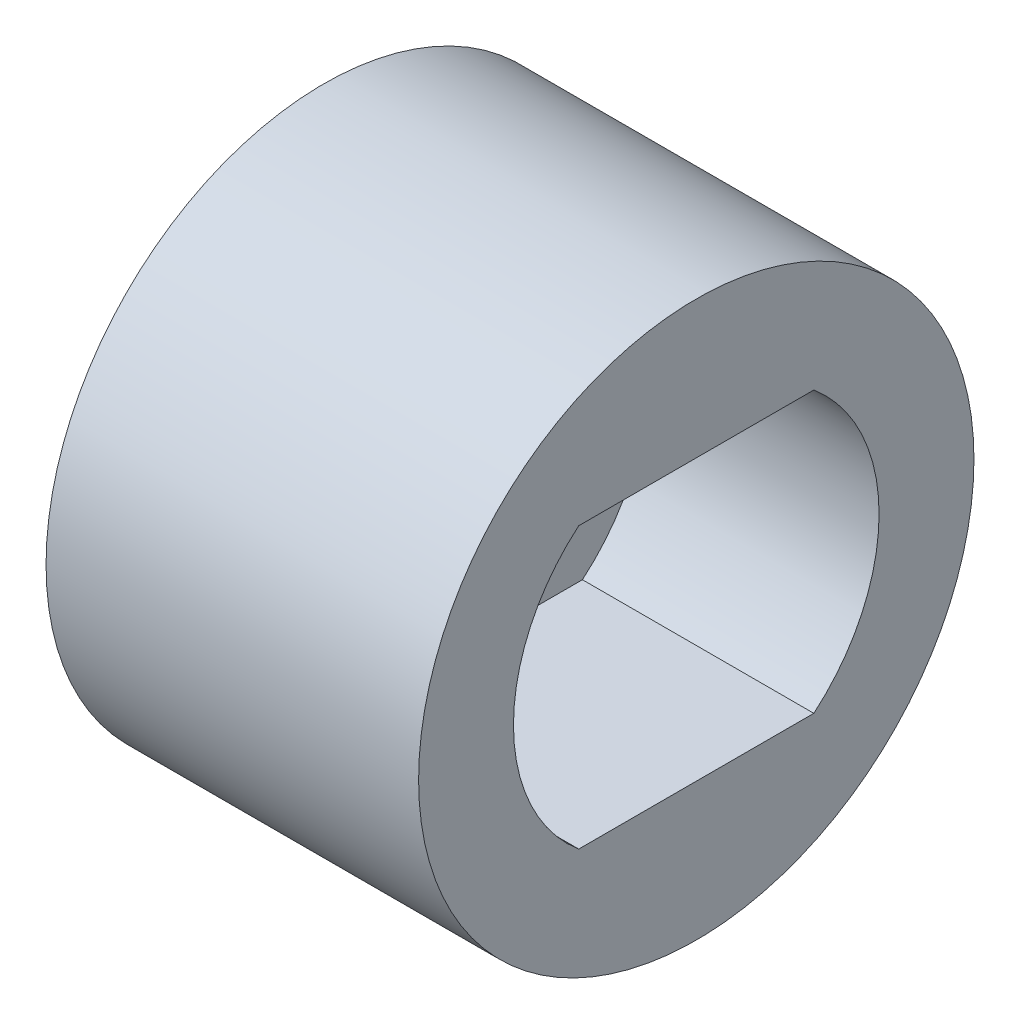
from build123d import *

# Parameters (mm, degrees)
BASPROSKE_W         = 5.1
BASPROSKE_H         = 2
TOOTHCUT_DEPTH      = 18.720327311
TEETHCUTS_COUNT     = 42
TEETHCUTS_ANGLE     = 351.428571429
EXTRUDE_START       = 11
SKETCH_1_R          = 12
SKETCH_1_R_2        = 2.5
EXTRUDE_1_DEPTH     = 11
CUT_EXTRUDE_1_REACH = 23.224
CUT_EXTRUDE_START   = 1
SKETCH_1_3_R        = 2.5


with BuildPart() as part:
    # BasProSke → Base-Revolve (revolve)
    with BuildSketch(Plane(origin=(0, 0, 0), x_dir=(1, 0, 0), z_dir=(0, 1, 0))):
        with Locations((2.55, 11)):
            Rectangle(BASPROSKE_W, BASPROSKE_H)
    revolve(axis=Axis((-10, 0, 0), (1, 0, 0)))

    # TooCutSke → ToothCut (cut, through all)
    with BuildSketch(Plane(origin=(0, 0, 0), x_dir=(0, 0, -1), z_dir=(1, 0, 0))):
        with BuildLine():
            ThreePointArc((0.617776516, 9.955450635), (0.41452492, 10.554683305), (0.140657406, 11.125110853))
            ThreePointArc((0.140657406, 11.125110853), (0, 11.126), (-0.140657406, 11.125110853))
            ThreePointArc((-0.140657406, 11.125110853), (-0.41452492, 10.554683305), (-0.617776516, 9.955450635))
            ThreePointArc((-0.617776516, 9.955450635), (0, 9.9746), (0.617776516, 9.955450635))
        make_face()
    toothcut = extrude(amount=TOOTHCUT_DEPTH, mode=Mode.SUBTRACT)

    # TeethCuts: ToothCut ×42 about axis
    teethcuts_axis = Axis((-10, 0, 0), (1, 0, 0))
    for i in range(1, TEETHCUTS_COUNT):
        add(toothcut.rotate(teethcuts_axis, i * TEETHCUTS_ANGLE / (TEETHCUTS_COUNT - 1)), mode=Mode.SUBTRACT)

    # 草图1 → 凸台-拉伸1 (add)
    with BuildSketch(Plane(origin=(5.1, 0, 0), x_dir=(0, 0, -1), z_dir=(1, 0, 0)).offset(EXTRUDE_START)):
        Circle(SKETCH_1_R)
        Circle(SKETCH_1_R_2, mode=Mode.SUBTRACT)
    extrude(amount=-EXTRUDE_1_DEPTH)

    # 草图1<3> → 切除-拉伸1 (cut, up to next)
    with BuildSketch(Plane(origin=(5.1, 0, 0), x_dir=(0, 0, -1), z_dir=(1, 0, 0)).offset(CUT_EXTRUDE_START), mode=Mode.PRIVATE) as cut_extrude_1_sk1:
        with BuildLine():
            ThreePointArc((-7.9, 0), (-7.160406947, -3.337449977), (-5.080108267, -6.05))
            Line((-5.080108267, -6.05), (5.080108267, -6.05))
            ThreePointArc((5.080108267, -6.05), (7.160406947, -3.337449977), (7.9, 0))
            ThreePointArc((7.9, 0), (7.160406947, 3.337449977), (5.080108267, 6.05))
            Line((5.080108267, 6.05), (-5.080108267, 6.05))
            ThreePointArc((-5.080108267, 6.05), (-7.160406947, 3.337449977), (-7.9, 0))
        make_face()
        Circle(SKETCH_1_3_R, mode=Mode.SUBTRACT)
    cut_extrude_1_tool1 = extrude(cut_extrude_1_sk1.sketch, amount=CUT_EXTRUDE_1_REACH, mode=Mode.PRIVATE) & part.part
    add(cut_extrude_1_tool1.solids().sort_by_distance((6.1, 3.253376, 6.980028))[0], mode=Mode.SUBTRACT)


solid = part.part
